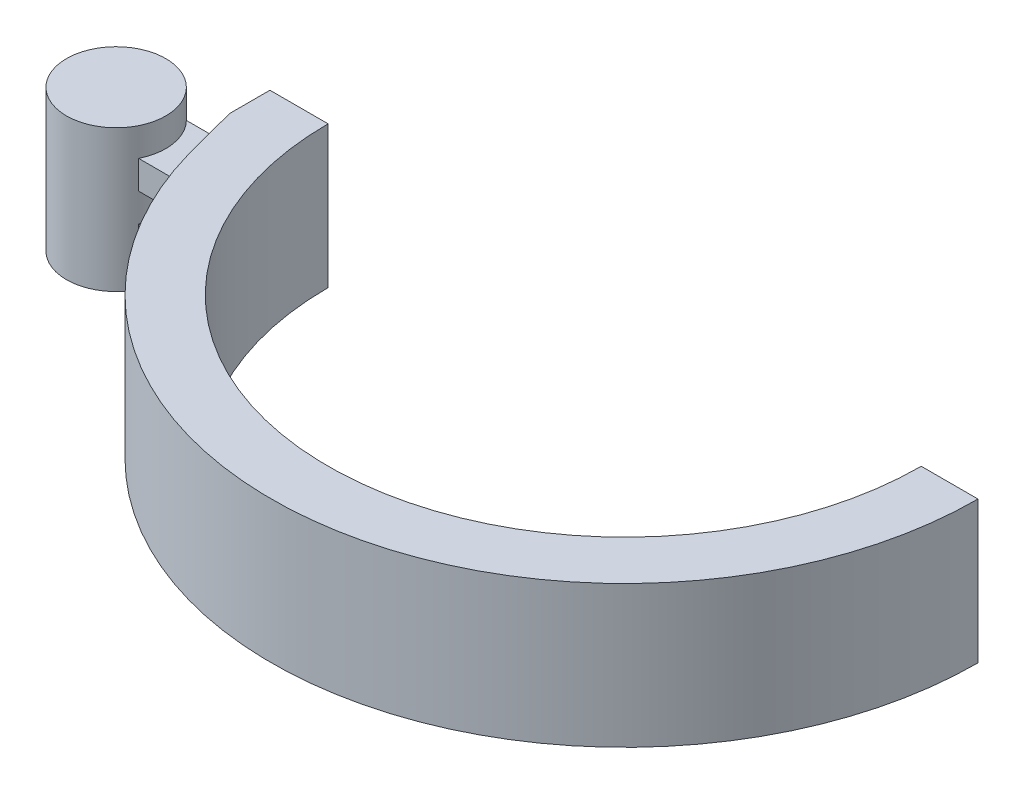
from build123d import *
from build123d.topology import SkipClean

# Parameters (mm, degrees)
BOSS_EXTRUDE2_DEPTH = 5
CUT_EXTRUDE1_START  = -1
CUT_EXTRUDE1_DEPTH  = 1
CUT_EXTRUDE2_START  = -2
CUT_EXTRUDE2_DEPTH  = 1
CUT_EXTRUDE3_START  = -2
CUT_EXTRUDE3_DEPTH  = 1


with BuildPart() as part:
    # Sketch2 → Boss-Extrude2 (new body)
    with BuildSketch(Plane(origin=(0, 0, 0), x_dir=(1, 0, 0), z_dir=(0, 1, 0))):
        with BuildLine():
            Line((4.85, 2.618089507), (2.8, 2.618089507))
            Line((2.8, 2.618089507), (2.8, 1.224744871))
            Line((2.8, 1.224744871), (1.25, 1.224744871))
            ThreePointArc((1.25, 1.224744871), (-1.728167758, -0.275565237), (1.568910286, -0.775255129))
            Line((1.568910286, -0.775255129), (3.321364344, -0.775255129))
            ThreePointArc((3.321364344, -0.775255129), (17.012963234, -9.713506373), (27.75, 2.618089507))
            Line((27.75, 2.618089507), (25.75, 2.618089507))
            ThreePointArc((25.75, 2.618089507), (15.3, -7.831910493), (4.85, 2.618089507))
        make_face()
    extrude(amount=BOSS_EXTRUDE2_DEPTH)

    # Sketch6 → Cut-Extrude1 (cut)
    with SkipClean():  # the faces are left unmerged after this step: merging them gives an invalid solid
        with BuildSketch(Plane(origin=(0, 5, 0), x_dir=(1, 0, 0), z_dir=(0, 1, 0)).offset(CUT_EXTRUDE1_START)):
            with BuildLine():
                Line((2.8, 1.224744871), (1.25, 1.224744871))
                ThreePointArc((1.25, 1.224744871), (1.728167758, 0.275565237), (1.568910286, -0.775255129))
                Line((1.568910286, -0.775255129), (3.321364344, -0.775255129))
                ThreePointArc((3.321364344, -0.775255129), (3.050160005, 0.22200193), (2.8, 1.224744871))
            make_face()
        extrude(amount=CUT_EXTRUDE1_DEPTH, mode=Mode.SUBTRACT)

    # Sketch8 → Cut-Extrude2 (cut)
    with SkipClean():  # the faces are left unmerged after this step: merging them gives an invalid solid
        with BuildSketch(Plane(origin=(0, 4, 0), x_dir=(1, 0, 0), z_dir=(0, 1, 0)).offset(CUT_EXTRUDE2_START)):
            with BuildLine():
                Line((2.8, 1.224744871), (1.25, 1.224744871))
                ThreePointArc((1.25, 1.224744871), (1.728167758, 0.275565237), (1.568910286, -0.775255129))
                Line((1.568910286, -0.775255129), (3.321364344, -0.775255129))
                ThreePointArc((3.321364344, -0.775255129), (3.050160005, 0.22200193), (2.8, 1.224744871))
            make_face()
        extrude(amount=CUT_EXTRUDE2_DEPTH, mode=Mode.SUBTRACT)

    # Sketch9 → Cut-Extrude3 (cut)
    with SkipClean():  # the faces are left unmerged after this step: merging them gives an invalid solid
        with BuildSketch(Plane(origin=(0, 2, 0), x_dir=(1, 0, 0), z_dir=(0, 1, 0)).offset(CUT_EXTRUDE3_START)):
            with BuildLine():
                Line((2.8, 1.224744871), (1.25, 1.224744871))
                ThreePointArc((1.25, 1.224744871), (1.728167758, 0.275565237), (1.568910286, -0.775255129))
                Line((1.568910286, -0.775255129), (3.321364344, -0.775255129))
                ThreePointArc((3.321364344, -0.775255129), (3.050160005, 0.22200193), (2.8, 1.224744871))
            make_face()
        extrude(amount=CUT_EXTRUDE3_DEPTH, mode=Mode.SUBTRACT)


solid = part.part
